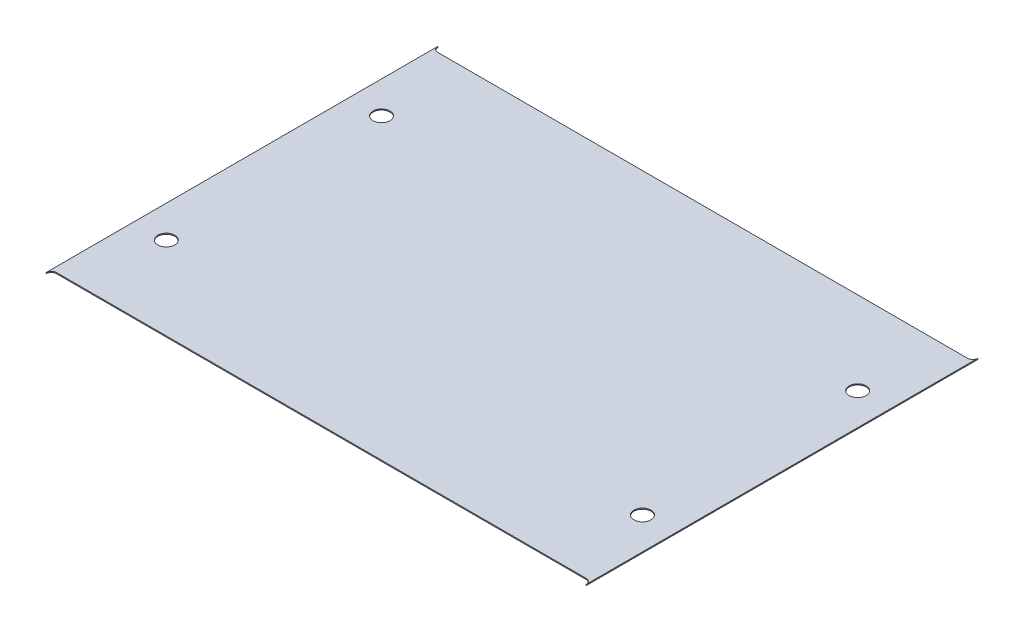
from build123d import *

# Parameters (mm, degrees)
SKETCH2_R           = 0.8
BOSS_EXTRUDE2_DEPTH = 0.1


with BuildPart() as part:
    # Sketch2 → Boss-Extrude2 (new body)
    with BuildSketch(Plane(origin=(0, 0, 0), x_dir=(1, 0, 0), z_dir=(0, 1, 0))):
        with BuildLine():
            Line((-49.928903971, 21.931275587), (-49.928903971, -15.068724413))
            ThreePointArc((-49.928903971, -15.068724413), (-49.782457361, -14.715171023), (-49.428903971, -14.568724413))
            Line((-49.428903971, -14.568724413), (0.571096029, -14.568724413))
            ThreePointArc((0.571096029, -14.568724413), (0.92464942, -14.715171023), (1.071096029, -15.068724413))
            Line((1.071096029, -15.068724413), (1.071096029, 21.931275587))
            ThreePointArc((1.071096029, 21.931275587), (0.92464942, 21.577722196), (0.571096029, 21.431275587))
            Line((0.571096029, 21.431275587), (-49.428903971, 21.431275587))
            ThreePointArc((-49.428903971, 21.431275587), (-49.782457361, 21.577722196), (-49.928903971, 21.931275587))
        make_face()
        with Locations(Location((-1.948903971, 13.591275587, 0), (0, 0, 270))):
            Circle(SKETCH2_R, mode=Mode.SUBTRACT)
        with Locations(Location((-46.908903971, 13.591275587, 0), (0, 0, 270))):
            Circle(SKETCH2_R, mode=Mode.SUBTRACT)
        with Locations(Location((-46.908903971, -6.728724413, 0), (0, 0, 270))):
            Circle(SKETCH2_R, mode=Mode.SUBTRACT)
        with Locations(Location((-1.948903971, -6.728724413, 0), (0, 0, 270))):
            Circle(SKETCH2_R, mode=Mode.SUBTRACT)
    extrude(amount=BOSS_EXTRUDE2_DEPTH)


solid = part.part
